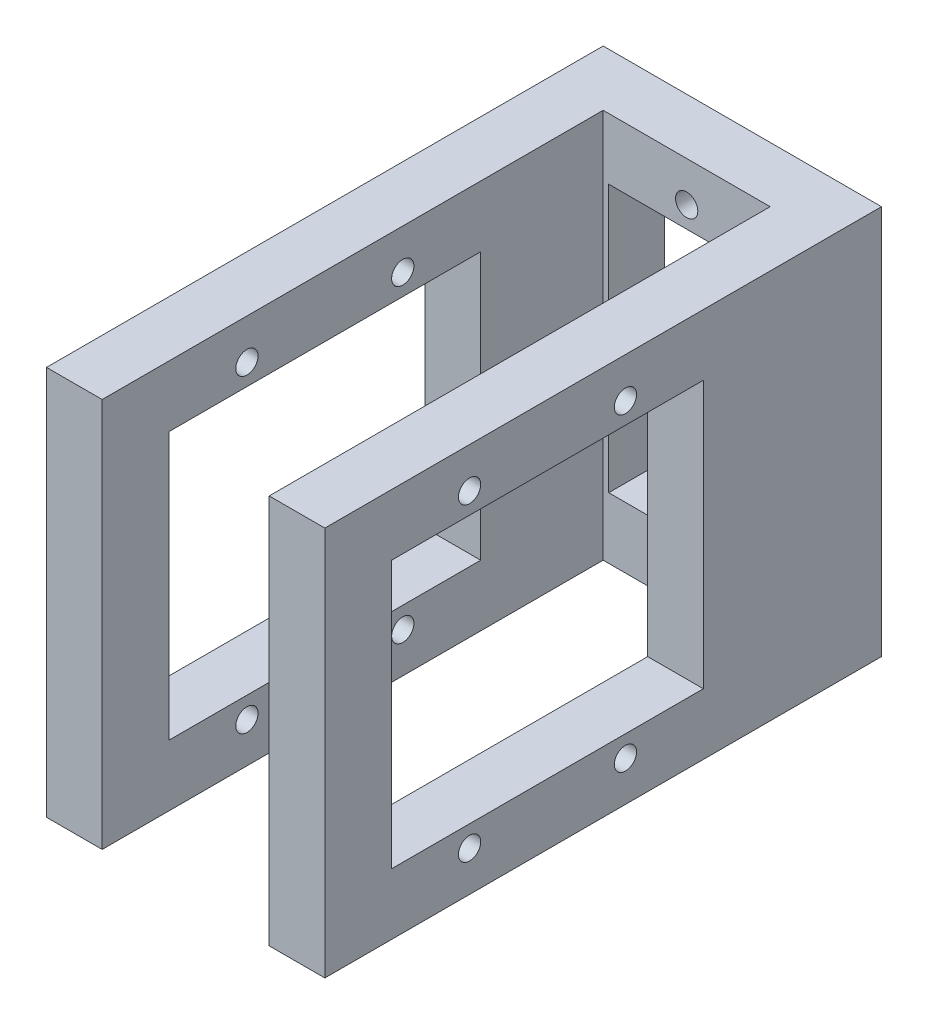
from build123d import *

# Parameters (mm, degrees)
SKETCH1_W           = 20
SKETCH1_H           = 35
SKETCH1_R           = 1
SKETCH1_W_2         = 14
SKETCH1_H_2         = 24
BOSS_EXTRUDE1_DEPTH = 5
SKETCH2_W           = 50
SKETCH2_H           = 35
BOSS_EXTRUDE2_DEPTH = 2.5
SKETCH3_R           = 1
SKETCH3_W           = 28
SKETCH3_H           = 24
CUT_EXTRUDE1_DEPTH  = 5


with BuildPart() as part:
    # Sketch1 → Boss-Extrude1 (new body)
    with BuildSketch(Plane.XY):
        Rectangle(SKETCH1_W, SKETCH1_H)
        with Locations((0, 13.9)):
            Circle(SKETCH1_R, mode=Mode.SUBTRACT)
        with Locations(Location((0, -13.9, 0), (0, 0, 180))):
            Circle(SKETCH1_R, mode=Mode.SUBTRACT)
        Rectangle(SKETCH1_W_2, SKETCH1_H_2, mode=Mode.SUBTRACT)
    extrude(amount=BOSS_EXTRUDE1_DEPTH)

    # Sketch2 → Boss-Extrude2 (add, symmetric)
    with BuildSketch(Plane(origin=(10, 0, 0), x_dir=(0, 0, -1), z_dir=(1, 0, 0))):
        with Locations((-25, 0)):
            Rectangle(SKETCH2_W, SKETCH2_H)
    boss_extrude2 = extrude(amount=BOSS_EXTRUDE2_DEPTH, both=True)

    # Sketch3 → Cut-Extrude1 (cut)
    with BuildSketch(Plane.ZY.offset(-7.5)):
        with Locations((23, 13.9)):
            Circle(SKETCH3_R)
        with Locations(Location((37, 13.9, 0), (0, 0, 180))):
            Circle(SKETCH3_R)
        with Locations((37, -13.9)):
            Circle(SKETCH3_R)
        with Locations(Location((23, -13.9, 0), (0, 0, 180))):
            Circle(SKETCH3_R)
        with Locations((30, 0)):
            Rectangle(SKETCH3_W, SKETCH3_H)
    cut_extrude1 = extrude(amount=-CUT_EXTRUDE1_DEPTH, mode=Mode.SUBTRACT)

    # Mirror2: Boss-Extrude2, Cut-Extrude1 across plane
    add(boss_extrude2.mirror(Plane.ZY))
    add(cut_extrude1.mirror(Plane.ZY), mode=Mode.SUBTRACT)


solid = part.part
